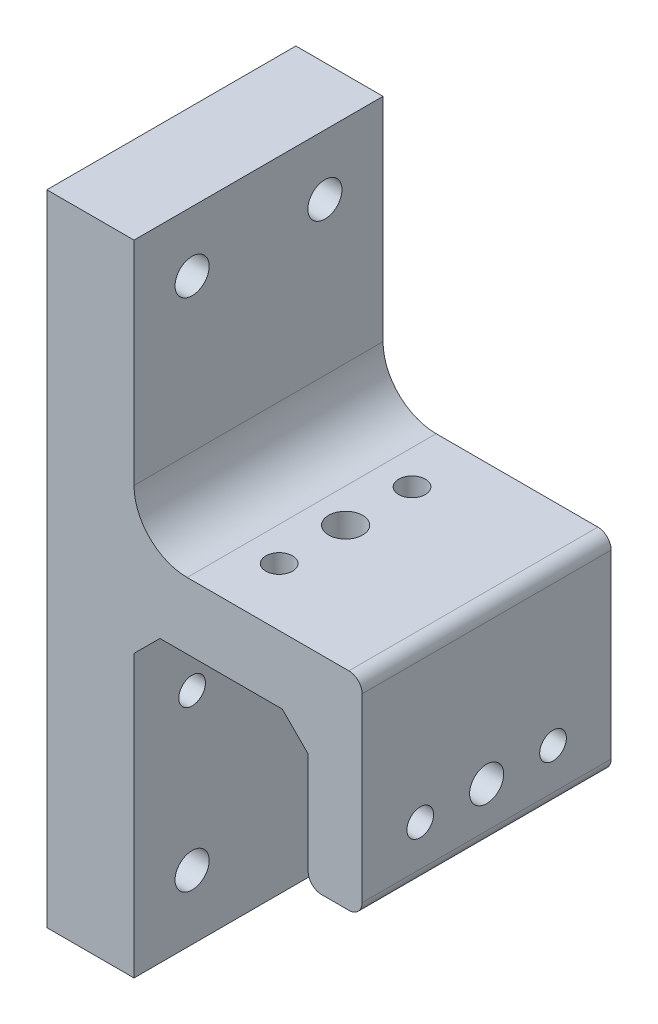
from build123d import *

# Parameters (mm, degrees)
BOSS_EXTRUDE1_DEPTH      = 23.8125
BOSS_EXTRUDE1_DEPTH_BACK = 23.8125
CUT_EXTRUDE1_DEPTH       = 41.213151732
CUT_EXTRUDE1_DEPTH_BACK  = 41.213151732
SKETCH6_R                = 2.5527
SKETCH6_R_2              = 3.2639
SKETCH7_R                = 1.5875
SKETCH7_W                = 6.5278
SKETCH7_H                = 6.5278
CUT_EXTRUDE2_DEPTH       = 41.213151732
SKETCH8_R                = 2.5527
CUT_EXTRUDE3_DEPTH       = 6.35
SKETCH14_R               = 3.2639
CUT_EXTRUDE6_DEPTH       = 46.858039931
SKETCH15_W               = 47.625
SKETCH15_H               = 33.3248
SKETCH15_R               = 2.5527
SKETCH15_W_2             = 6.5278
SKETCH15_H_2             = 6.5278
BOSS_EXTRUDE2_DEPTH      = 6.35
BOSS_EXTRUDE3_START      = 6.35
SKETCH16_W               = 47.625
SKETCH16_H               = 33.3248
SKETCH16_R               = 2.5527
SKETCH16_R_2             = 3.2639
BOSS_EXTRUDE3_DEPTH      = 6.35
BOSS_EXTRUDE4_START      = 6.35
SKETCH17_W               = 53.9496
SKETCH17_H               = 47.625
SKETCH17_R               = 2.5527
SKETCH17_R_2             = 3.2639
BOSS_EXTRUDE4_DEPTH      = 6.35
BOSS_EXTRUDE5_DEPTH      = 6.35
BOSS_EXTRUDE5_DEPTH_BACK = 10.31875
SKETCH19_R               = 2.5527
SKETCH19_W               = 6.5278
SKETCH19_H               = 6.5278
FILLET2_R                = 10.16
FILLET3_R                = 2.54
SKETCH20_R               = 3.2639
CUT_EXTRUDE7_DEPTH       = 93.145886885


with BuildPart() as part:
    # Sketch4 → Boss-Extrude1 (new, two sides: drawn at the far end of the back side and taken through both)
    with BuildSketch(Plane.XY.offset(-BOSS_EXTRUDE1_DEPTH_BACK)):
        Polygon((-20.6248, -24.9936), (-16.65605, -24.9936), (-16.65605, -2.9797375), (-11.6951125, 1.9812), (11.6951125, 1.9812), (16.65605, -2.9797375), (16.65605, -24.9936), (20.6248, -24.9936), (20.6248, 8.3312), (-20.6248, 8.3312), align=None)
    extrude(amount=BOSS_EXTRUDE1_DEPTH + BOSS_EXTRUDE1_DEPTH_BACK)

    # Sketch6 → Cut-Extrude1 (cut, two sides: drawn at the far end of the back side and taken through both)
    with BuildSketch(Plane(origin=(0, 0, 0), x_dir=(0, 0, -1), z_dir=(1, 0, 0)).offset(-CUT_EXTRUDE1_DEPTH_BACK)):
        with Locations((-12.7, -14.6812)):
            Circle(SKETCH6_R)
        with Locations((0, -14.6812)):
            Circle(SKETCH6_R_2)
        with Locations((12.7, -14.6812)):
            Circle(SKETCH6_R)
        with Locations((12.7, 16.6624)):
            Circle(SKETCH6_R_2)
        with Locations((-12.7, 16.6624)):
            Circle(SKETCH6_R_2)
    extrude(amount=CUT_EXTRUDE1_DEPTH + CUT_EXTRUDE1_DEPTH_BACK, mode=Mode.SUBTRACT)

    # Sketch7 → Cut-Extrude2 (cut, through all)
    with BuildSketch(Plane(origin=(0, 0, 0), x_dir=(0, 0, -1), z_dir=(1, 0, 0))):
        with Locations((-12.7, -14.6812)):
            Circle(SKETCH7_R)
        with Locations((12.7, -14.6812)):
            Circle(SKETCH7_R)
        with Locations((0, -14.6812)):
            Rectangle(SKETCH7_W, SKETCH7_H)
    extrude(amount=-CUT_EXTRUDE2_DEPTH, mode=Mode.SUBTRACT)

    # Sketch8 → Cut-Extrude3 (cut)
    with BuildSketch(Plane(origin=(0, 8.3312, 0), x_dir=(1, 0, 0), z_dir=(0, 1, 0))):
        with Locations(Location((0, 12.7, 0), (0, 0, 180))):
            Circle(SKETCH8_R)
        with Locations(Location((0, -12.7, 0), (0, 0, 180))):
            Circle(SKETCH8_R)
    extrude(amount=-CUT_EXTRUDE3_DEPTH, mode=Mode.SUBTRACT)

    # Sketch14 → Cut-Extrude6 (cut, through all)
    with BuildSketch(Plane(origin=(0, 8.3312, 0), x_dir=(1, 0, 0), z_dir=(0, 1, 0))):
        with Locations(Location((0, 0, 0), (0, 0, 180))):
            Circle(SKETCH14_R)
    extrude(amount=-CUT_EXTRUDE6_DEPTH, mode=Mode.SUBTRACT)

    # Sketch15 → Boss-Extrude2 (add)
    with BuildSketch(Plane.ZY.offset(20.6248)):
        with Locations((0, -8.3312)):
            Rectangle(SKETCH15_W, SKETCH15_H)
        with Locations(Location((12.7, -14.6812, 0), (0, 0, 180))):
            Circle(SKETCH15_R, mode=Mode.SUBTRACT)
        with Locations(Location((-12.7, -14.6812, 0), (0, 0, 180))):
            Circle(SKETCH15_R, mode=Mode.SUBTRACT)
        with Locations((0, -14.6812)):
            Rectangle(SKETCH15_W_2, SKETCH15_H_2, mode=Mode.SUBTRACT)
    extrude(amount=BOSS_EXTRUDE2_DEPTH)

    # Sketch16 → Boss-Extrude3 (add)
    with BuildSketch(Plane(origin=(20.6248, 0, 0), x_dir=(0, 0, -1), z_dir=(1, 0, 0)).offset(BOSS_EXTRUDE3_START)):
        with Locations((0, -8.3312)):
            Rectangle(SKETCH16_W, SKETCH16_H)
        with Locations((-12.7, -14.6812)):
            Circle(SKETCH16_R, mode=Mode.SUBTRACT)
        with Locations((0, -14.6812)):
            Circle(SKETCH16_R_2, mode=Mode.SUBTRACT)
        with Locations((12.7, -14.6812)):
            Circle(SKETCH16_R, mode=Mode.SUBTRACT)
    extrude(amount=-BOSS_EXTRUDE3_DEPTH)

    # Sketch17 → Boss-Extrude4 (add)
    with BuildSketch(Plane(origin=(0, 8.3312, 0), x_dir=(1, 0, 0), z_dir=(0, 1, 0)).offset(BOSS_EXTRUDE4_START)):
        Rectangle(SKETCH17_W, SKETCH17_H)
        with Locations(Location((0, -12.7, 0), (0, 0, 180))):
            Circle(SKETCH17_R, mode=Mode.SUBTRACT)
        with Locations(Location((0, 12.7, 0), (0, 0, 180))):
            Circle(SKETCH17_R, mode=Mode.SUBTRACT)
        with Locations(Location((0, 0, 0), (0, 0, 180))):
            Circle(SKETCH17_R_2, mode=Mode.SUBTRACT)
    extrude(amount=-BOSS_EXTRUDE4_DEPTH)

    # Sketch19 → Boss-Extrude5 (add, two sides: drawn at the far end of the back side and taken through both)
    with BuildSketch(Plane.ZY.offset(26.9748).offset(-BOSS_EXTRUDE5_DEPTH_BACK)):
        Polygon((-23.8125, 14.6812), (-23.8125, 65.4812), (23.8125, 65.4812), (23.8125, 14.6812), (23.8125, -24.9936), (23.8125, -56.7436), (-23.8125, -56.7436), (-23.8125, -24.9936), align=None)
        with Locations(Location((12.7, -14.6812, 0), (0, 0, 180))):
            Circle(SKETCH19_R, mode=Mode.SUBTRACT)
        with Locations(Location((-12.7, -14.6812, 0), (0, 0, 180))):
            Circle(SKETCH19_R, mode=Mode.SUBTRACT)
        with Locations((0, -14.6812)):
            Rectangle(SKETCH19_W, SKETCH19_H, mode=Mode.SUBTRACT)
    extrude(amount=BOSS_EXTRUDE5_DEPTH + BOSS_EXTRUDE5_DEPTH_BACK)

    # Fillet2
    fillet2_edges = [part.edges().sort_by_distance(p)[0] for p in [
        (-16.65605, 14.6812, 0),
    ]]
    fillet(fillet2_edges, radius=FILLET2_R)

    # Fillet3
    fillet3_edges = [part.edges().sort_by_distance(p)[0] for p in [
        (16.65605, -24.9936, 0),
        (26.9748, -24.9936, 0),
        (26.9748, 14.6812, 0),
    ]]
    fillet(fillet3_edges, radius=FILLET3_R)

    # Sketch20 → Cut-Extrude7 (cut, through all)
    with BuildSketch(Plane.ZY.offset(33.3248)):
        with Locations((-12.7, 53.975)):
            Circle(SKETCH20_R)
        with Locations((-12.7, -44.45)):
            Circle(SKETCH20_R)
        with Locations((12.7, 53.975)):
            Circle(SKETCH20_R)
        with Locations((12.7, -44.45)):
            Circle(SKETCH20_R)
    extrude(amount=-CUT_EXTRUDE7_DEPTH, mode=Mode.SUBTRACT)


solid = part.part
